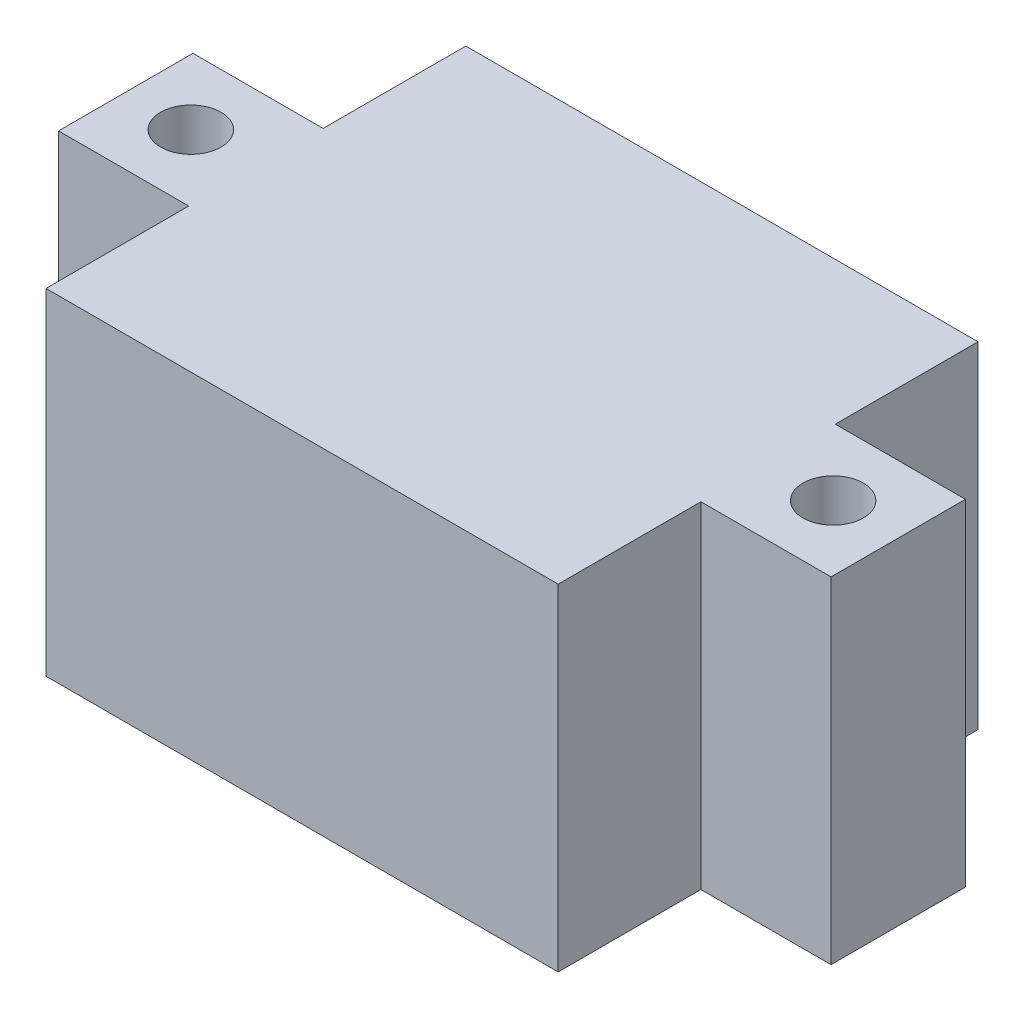
from build123d import *

# Parameters (mm, degrees)
BOSS_EXTRU_1_DEPTH = 20
D_GAGEMENT_M31_D   = 3.6


with BuildPart() as part:
    # Esquisse1 → Boss.-Extru.1 (new body)
    with BuildSketch(Plane(origin=(0, 0, 0), x_dir=(1, 0, 0), z_dir=(0, 1, 0))):
        Polygon((-15.25, -12.5), (15.25, -12.5), (15.25, -4.001343409), (23, -4.001343409), (23, 4.001343409), (15.25, 4.001343409), (15.25, 12.5), (-15.25, 12.5), (-15.25, 4.001343409), (-23, 4.001343409), (-23, -4.001343409), (-15.25, -4.001343409), align=None)
    extrude(amount=BOSS_EXTRU_1_DEPTH)

    # Dégagement M31 (through all)
    with Locations(Plane(origin=(0, 20, 0), x_dir=(1, 0, 0), z_dir=(0, 1, 0))):
        with Locations((-19.125, 0), (19.125, 0)):
            Hole(D_GAGEMENT_M31_D / 2)


solid = part.part
